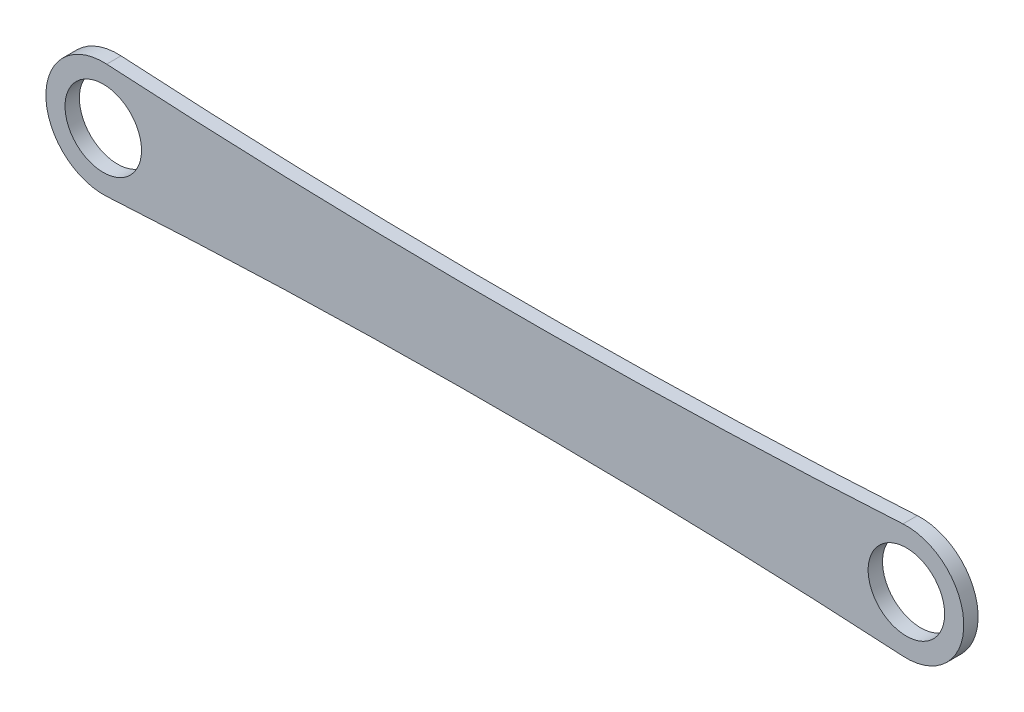
from build123d import *

# Parameters (mm, degrees)
SKETCH1_R           = 4
BOSS_EXTRUDE1_DEPTH = 1.5


with BuildPart() as part:
    # Sketch1 → Boss-Extrude1 (new body)
    with BuildSketch(Plane.XY):
        with BuildLine():
            ThreePointArc((0.35694051, 5.989373379), (-6, 0), (0.35694051, -5.989373379))
            ThreePointArc((0.35694051, -5.989373379), (42, -4.749600922), (83.64305949, -5.989373379))
            ThreePointArc((83.64305949, -5.989373379), (90, 0), (83.64305949, 5.989373379))
            ThreePointArc((83.64305949, 5.989373379), (42, 4.749600922), (0.35694051, 5.989373379))
        make_face()
        Circle(SKETCH1_R, mode=Mode.SUBTRACT)
        with Locations((84, 0)):
            Circle(SKETCH1_R, mode=Mode.SUBTRACT)
    extrude(amount=BOSS_EXTRUDE1_DEPTH)


solid = part.part
